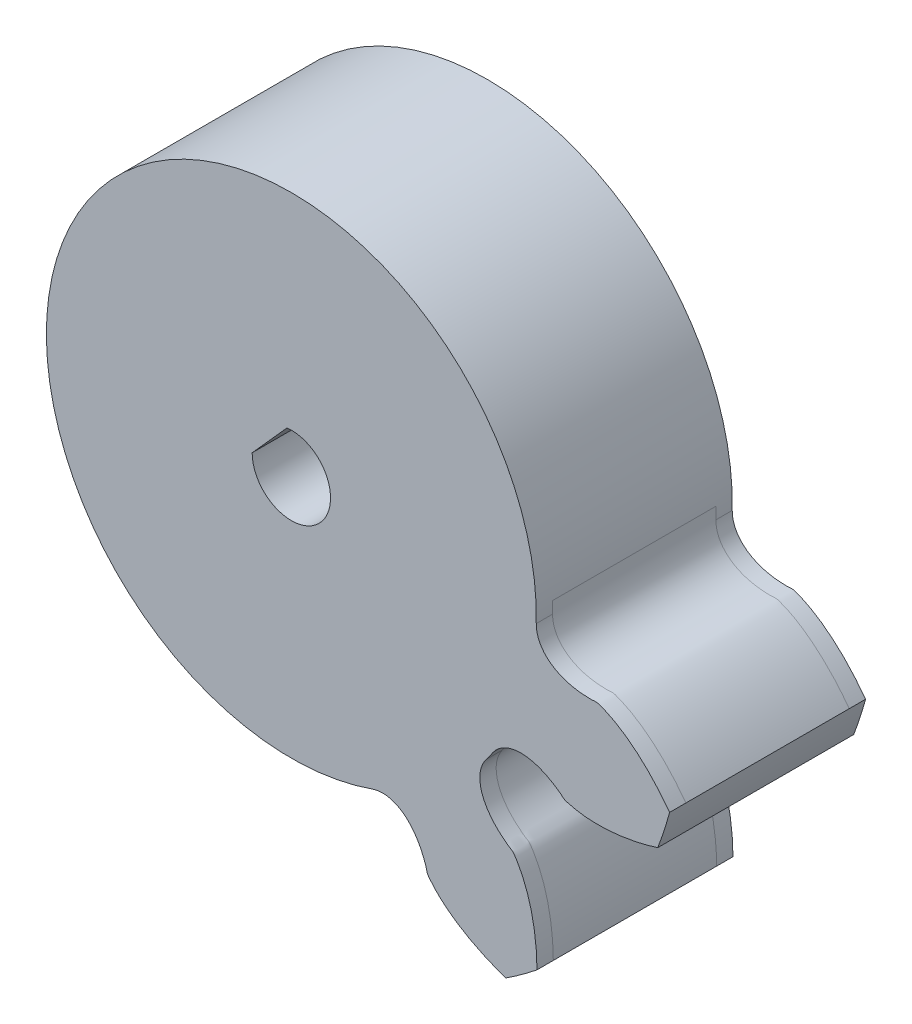
from build123d import *

# Parameters (mm, degrees)
SKETCHREVOLVESPUR01_W       = 6
SKETCHREVOLVESPUR01_H       = 11.99999982
TOOTHEXTRUDECUTSPUR01_DEPTH = 2.5
PATTERNSPUR01_COUNT         = 3
PATTERNSPUR01_ANGLE         = 72
CUT_EXTRUDE4_DEPTH          = 18.999999926
SCALE1_SCALE                = 1.25
CUT_EXTRUDE6_DEPTH          = 21.575620634
BOSS_EXTRUDE3_START         = 3
BOSS_EXTRUDE3_DEPTH         = 3
SKETCH13_R                  = 1
CUT_EXTRUDE7_DEPTH          = 3


with BuildPart() as part:
    # SketchRevolveSpur01 → Spur01 (revolve)
    with BuildSketch(Plane(origin=(0, 0, 0), x_dir=(0, 0, -1), z_dir=(1, 0, 0)), mode=Mode.PRIVATE) as spur01_sk:
        with Locations((0, 5.99999991)):
            Rectangle(SKETCHREVOLVESPUR01_W, SKETCHREVOLVESPUR01_H)
    revolve(spur01_sk.sketch.rotate(Axis((0, 0, 0), (0, 0, -1)), 90), axis=Axis((0, 0, 0), (0, 0, -1)))

    # SketchToothSpur01 → ToothExtrudeCutSpur01 (cut, symmetric)
    with BuildSketch(Plane.XY):
        with BuildLine():
            ThreePointArc((11.655653982, 3.248957658), (12.099999818, 0), (11.655653982, -3.248957658))
            add(Edge.make_bspline(
                [(11.655653982, -3.248957658), (11.542287726, -3.089305996), (11.367738762, -2.862436555), (11.123534782, -2.583010481), (10.947999265, -2.397865834), (10.776192053, -2.230764528), (10.609269419, -2.081082218), (10.44834245, -1.948131117), (10.294473867, -1.831161756), (10.148674628, -1.729370493), (10.011902198, -1.641886679), (9.885053932, -1.567827248), (9.768976882, -1.506134891), (9.664426294, -1.45610176), (9.572183953, -1.415767403), (9.474218443, -1.379996288), (9.351476065, -1.328641113), (9.21414192, -1.355832051), (9.089686, -1.350996807), (8.991189949, -1.347769188), (8.895083812, -1.340387735), (8.801254328, -1.330142809), (8.709751295, -1.316726231), (8.620575928, -1.300229256), (8.533736646, -1.280620754), (8.449236025, -1.257878982), (8.367076474, -1.231952957), (8.287262228, -1.202767588), (8.209803923, -1.170216951), (8.134724742, -1.134160443), (8.062069108, -1.094418466), (7.991914548, -1.050769425), (7.924387429, -1.002949027), (7.859683092, -0.950653937), (7.798090337, -0.893552503), (7.740018842, -0.831306192), (7.686026832, -0.763605636), (7.636840194, -0.690224751), (7.593362614, -0.611092562), (7.55662796, -0.526379885), (7.527823561, -0.436575845), (7.507840639, -0.342571173), (7.499499015, -0.256553159), (7.496355153, -0.142125776), (7.502676626, 0), (7.496355153, 0.142125776), (7.499499015, 0.256553159), (7.507840639, 0.342571173), (7.527823561, 0.436575845), (7.55662796, 0.526379885), (7.593362614, 0.611092562), (7.636840194, 0.690224751), (7.686026832, 0.763605636), (7.740018842, 0.831306192), (7.798090337, 0.893552503), (7.859683092, 0.950653937), (7.924387429, 1.002949027), (7.991914548, 1.050769425), (8.062069108, 1.094418466), (8.134724742, 1.134160443), (8.209803923, 1.170216951), (8.287262228, 1.202767588), (8.367076474, 1.231952957), (8.449236025, 1.257878982), (8.533736646, 1.280620754), (8.620575928, 1.300229256), (8.709751295, 1.316726231), (8.801254328, 1.330142809), (8.895083812, 1.340387735), (8.991189949, 1.347769188), (9.089686, 1.350996807), (9.21414192, 1.355832051), (9.351476065, 1.328641113), (9.474218443, 1.379996288), (9.572183953, 1.415767403), (9.664426294, 1.45610176), (9.768976882, 1.506134891), (9.885053932, 1.567827248), (10.011902198, 1.641886679), (10.148674628, 1.729370493), (10.294473867, 1.831161756), (10.44834245, 1.948131117), (10.609269419, 2.081082218), (10.776192053, 2.230764528), (10.947999265, 2.397865834), (11.123534782, 2.583010481), (11.367738762, 2.862436555), (11.542287726, 3.089305996), (11.655653982, 3.248957658)],
                knots=[0, 0, 0, 0, 0.051709588, 0.075523214, 0.097976061, 0.11906813, 0.138799421, 0.157169932, 0.174179665, 0.18982862, 0.204116796, 0.217044194, 0.228610813, 0.238816653, 0.247661716, 0.255145999, 0.266488168, 0.281932497, 0.29079109, 0.29945754, 0.3079389, 0.316243077, 0.32437896, 0.33235655, 0.340187113, 0.347883348, 0.355459572, 0.362931907, 0.370318475, 0.377639574, 0.384917807, 0.392178142, 0.399447816, 0.40675603, 0.414133302, 0.42161038, 0.429216569, 0.436977418, 0.444911792, 0.453028613, 0.461323803, 0.469778278, 0.478357898, 0.484105769, 0.5, 0.515894231, 0.521642102, 0.530221722, 0.538676197, 0.546971387, 0.555088208, 0.563022582, 0.570783431, 0.57838962, 0.585866698, 0.59324397, 0.600552184, 0.607821858, 0.615082193, 0.622360426, 0.629681525, 0.637068093, 0.644540428, 0.652116652, 0.659812887, 0.66764345, 0.67562104, 0.683756923, 0.6920611, 0.70054246, 0.70920891, 0.718067503, 0.733511832, 0.744854001, 0.752338284, 0.761183347, 0.771389187, 0.782955806, 0.795883204, 0.81017138, 0.825820335, 0.842830068, 0.861200579, 0.88093187, 0.902023939, 0.924476786, 0.948290412, 1, 1, 1, 1], degree=3))
        make_face()
    toothextrudecutspur01 = extrude(amount=TOOTHEXTRUDECUTSPUR01_DEPTH, both=True, mode=Mode.SUBTRACT)

    # PatternSpur01: ToothExtrudeCutSpur01 ×3 about axis
    patternspur01_axis = Axis((0, 0, 55), (0, 0, -1))
    for i in range(1, PATTERNSPUR01_COUNT):
        add(toothextrudecutspur01.rotate(patternspur01_axis, i * PATTERNSPUR01_ANGLE / (PATTERNSPUR01_COUNT - 1)), mode=Mode.SUBTRACT)

    # Sketch5 → Cut-Extrude4 (cut, through all)
    with BuildSketch(Plane.XY.offset(3)):
        with BuildLine():
            ThreePointArc((2.145249768, -7.186647462), (-6.067627367, 4.408389326), (7.497826535, 0.180542427))
            add(Edge.make_bspline(
                [(7.497826535, 0.180542427), (7.498008575, 0.202305514), (7.499499015, 0.256553159), (7.507840639, 0.342571173), (7.527823561, 0.436575845), (7.55662796, 0.526379885), (7.593362614, 0.611092562), (7.636840194, 0.690224751), (7.686026832, 0.763605636), (7.740018842, 0.831306192), (7.798090337, 0.893552503), (7.859683092, 0.950653937), (7.924387429, 1.002949027), (7.991914548, 1.050769425), (8.062069108, 1.094418466), (8.134724742, 1.134160443), (8.209803923, 1.170216951), (8.287262228, 1.202767588), (8.367076474, 1.231952957), (8.449236025, 1.257878982), (8.533736646, 1.280620754), (8.620575928, 1.300229256), (8.709751295, 1.316726231), (8.801254328, 1.330142809), (8.895083812, 1.340387735), (8.991189949, 1.347769188), (9.089686, 1.350996807), (9.21414192, 1.355832051), (9.351476065, 1.328641113), (9.474218443, 1.379996288), (9.572183953, 1.415767403), (9.664426294, 1.45610176), (9.768976882, 1.506134891), (9.885053932, 1.567827248), (10.011902198, 1.641886679), (10.148674628, 1.729370493), (10.294473867, 1.831161756), (10.44834245, 1.948131117), (10.609269419, 2.081082218), (10.776192053, 2.230764528), (10.947999265, 2.397865834), (11.123534782, 2.583010481), (11.339604557, 2.83024449), (11.489806134, 3.021747144), (11.580533103, 3.145035568)],
                knots=[0.515894231, 0.515894231, 0.515894231, 0.515894231, 0.521642102, 0.530221722, 0.538676197, 0.546971387, 0.555088208, 0.563022582, 0.570783431, 0.57838962, 0.585866698, 0.59324397, 0.600552184, 0.607821858, 0.615082193, 0.622360426, 0.629681525, 0.637068093, 0.644540428, 0.652116652, 0.659812887, 0.66764345, 0.67562104, 0.683756923, 0.6920611, 0.70054246, 0.70920891, 0.718067503, 0.733511832, 0.744854001, 0.752338284, 0.761183347, 0.771389187, 0.782955806, 0.795883204, 0.81017138, 0.825820335, 0.842830068, 0.861200579, 0.88093187, 0.902023939, 0.924476786, 0.948290412, 0.988712393, 0.988712393, 0.988712393, 0.988712393], degree=3))
            ThreePointArc((11.580533103, 3.145035568), (-9.708203787, 7.053422922), (0.587474962, -11.985610908))
            add(Edge.make_bspline(
                [(0.587474962, -11.985610908), (0.676693046, -11.861226215), (0.812408053, -11.659198451), (0.980772335, -11.377304374), (1.1026119, -11.153147334), (1.208443338, -10.938111822), (1.299217744, -10.733104587), (1.375932586, -10.538969794), (1.439629052, -10.356486555), (1.491383854, -10.186368009), (1.532320901, -10.029255713), (1.563557335, -9.88573022), (1.586360472, -9.756270398), (1.601636899, -9.641375792), (1.6114927, -9.541184111), (1.615240045, -9.436959492), (1.626152238, -9.304354932), (1.557853535, -9.182144861), (1.523993131, -9.062286074), (1.496625826, -8.967613374), (1.473947574, -8.873930012), (1.454696173, -8.781527013), (1.439180105, -8.690356507), (1.427312956, -8.600447848), (1.419126937, -8.511799422), (1.414643518, -8.424406961), (1.413911936, -8.338257003), (1.417004913, -8.253330369), (1.424026476, -8.169604443), (1.43511751, -8.087057825), (1.45046255, -8.005677265), (1.470296304, -7.925468018), (1.494909177, -7.846468596), (1.524650025, -7.768771043), (1.559923507, -7.692547539), (1.601178188, -7.618083097), (1.648880794, -7.545813021), (1.703470656, -7.476357808), (1.765294529, -7.410554982), (1.83450944, -7.349440593), (1.911017108, -7.294295007), (1.994245802, -7.246241077), (2.073476091, -7.211726693), (2.124608096, -7.193545757), (2.145249768, -7.186647462)],
                knots=[0.011287607, 0.011287607, 0.011287607, 0.011287607, 0.051709588, 0.075523214, 0.097976061, 0.11906813, 0.138799421, 0.157169932, 0.174179665, 0.18982862, 0.204116796, 0.217044194, 0.228610813, 0.238816653, 0.247661716, 0.255145999, 0.266488168, 0.281932497, 0.29079109, 0.29945754, 0.3079389, 0.316243077, 0.32437896, 0.33235655, 0.340187113, 0.347883348, 0.355459572, 0.362931907, 0.370318475, 0.377639574, 0.384917807, 0.392178142, 0.399447816, 0.40675603, 0.414133302, 0.42161038, 0.429216569, 0.436977418, 0.444911792, 0.453028613, 0.461323803, 0.469778278, 0.478357898, 0.484105769, 0.484105769, 0.484105769, 0.484105769], degree=3))
        make_face()
        with BuildLine():
            add(Edge.make_bspline(
                [(6.171989263, -4.26104997), (6.184928559, -4.243550263), (6.218020316, -4.200539055), (6.275328951, -4.135852103), (6.346750035, -4.071546393), (6.422838774, -4.0158242), (6.502350595, -3.968882292), (6.584037429, -3.930418487), (6.666962457, -3.899963284), (6.7504363, -3.876928091), (6.83400459, -3.860703336), (6.917397556, -3.850710619), (7.000482747, -3.846435256), (7.083221458, -3.847439187), (7.165633953, -3.853362187), (7.247773342, -3.863916162), (7.32970716, -3.87887627), (7.411505029, -3.8980711), (7.493230841, -3.921373278), (7.574938248, -3.948690855), (7.656667965, -3.979960595), (7.738448009, -4.015139832), (7.820289074, -4.054209465), (7.90220265, -4.097139358), (7.984134114, -4.144002626), (8.06622432, -4.194520675), (8.147806447, -4.249804003), (8.251335487, -4.319045562), (8.346458711, -4.421766478), (8.475945195, -4.452365428), (8.576226692, -4.48100867), (8.674560253, -4.502596178), (8.788552192, -4.523571819), (8.918722356, -4.541890031), (9.0648758, -4.556534234), (9.226948716, -4.566151158), (9.404734182, -4.569498939), (9.597969345, -4.565310422), (9.806308695, -4.552341221), (10.029332996, -4.529360351), (10.266547634, -4.4951583), (10.517384143, -4.448550322), (10.837508767, -4.375536435), (11.071586832, -4.308893805), (11.217453609, -4.262479349)],
                knots=[0.515894231, 0.515894231, 0.515894231, 0.515894231, 0.521642102, 0.530221722, 0.538676197, 0.546971387, 0.555088208, 0.563022582, 0.570783431, 0.57838962, 0.585866698, 0.59324397, 0.600552184, 0.607821858, 0.615082193, 0.622360426, 0.629681525, 0.637068093, 0.644540428, 0.652116652, 0.659812887, 0.66764345, 0.67562104, 0.683756923, 0.6920611, 0.70054246, 0.70920891, 0.718067503, 0.733511832, 0.744854001, 0.752338284, 0.761183347, 0.771389187, 0.782955806, 0.795883204, 0.81017138, 0.825820335, 0.842830068, 0.861200579, 0.88093187, 0.902023939, 0.924476786, 0.948290412, 0.988712393, 0.988712393, 0.988712393, 0.988712393], degree=3))
            ThreePointArc((6.171989263, -4.26104997), (6.120251718, -4.335033705), (6.067627375, -4.408389314))
            ThreePointArc((6.067627375, -4.408389314), (6.014123853, -4.481106179), (5.959748911, -4.553173753))
            add(Edge.make_bspline(
                [(7.520242559, -9.351253794), (7.519310017, -9.19818339), (7.510356824, -8.954968216), (7.480873208, -8.627949074), (7.447687285, -8.37498672), (7.406912015, -8.138813178), (7.359849821, -7.919602984), (7.307803865, -7.717452784), (7.252074432, -7.532380899), (7.193951773, -7.364331395), (7.134722249, -7.213162685), (7.075630887, -7.078687808), (7.017984438, -6.960549264), (6.962809972, -6.858618316), (6.911892291, -6.771768449), (6.853662262, -6.685246327), (6.784547407, -6.571552958), (6.657459318, -6.512827904), (6.559614449, -6.435762755), (6.481826616, -6.37525703), (6.408413827, -6.31279554), (6.338525996, -6.249355633), (6.272384555, -6.18471726), (6.209936846, -6.118954962), (6.15120798, -6.0520485), (6.096212818, -5.983981802), (6.044983281, -5.914715035), (5.997566929, -5.844189938), (5.954034628, -5.772327071), (5.914487779, -5.699026307), (5.879067884, -5.624168463), (5.847967915, -5.54761983), (5.821445453, -5.469240872), (5.799836828, -5.388901), (5.783570623, -5.306501657), (5.77317726, -5.222009765), (5.769290195, -5.135503157), (5.772629571, -5.047225593), (5.783968203, -4.957650828), (5.804042106, -4.867524745), (5.833524348, -4.777940949), (5.872612384, -4.690143905), (5.916423989, -4.615650786), (5.947104164, -4.570887461), (5.959748911, -4.553173753)],
                knots=[0.011287607, 0.011287607, 0.011287607, 0.011287607, 0.051709588, 0.075523214, 0.097976061, 0.11906813, 0.138799421, 0.157169932, 0.174179665, 0.18982862, 0.204116796, 0.217044194, 0.228610813, 0.238816653, 0.247661716, 0.255145999, 0.266488168, 0.281932497, 0.29079109, 0.29945754, 0.3079389, 0.316243077, 0.32437896, 0.33235655, 0.340187113, 0.347883348, 0.355459572, 0.362931907, 0.370318475, 0.377639574, 0.384917807, 0.392178142, 0.399447816, 0.40675603, 0.414133302, 0.42161038, 0.429216569, 0.436977418, 0.444911792, 0.453028613, 0.461323803, 0.469778278, 0.478357898, 0.484105769, 0.484105769, 0.484105769, 0.484105769], degree=3))
            ThreePointArc((7.520242559, -9.351253794), (9.708203787, -7.053422922), (11.217453609, -4.262479349))
        make_face()
        with BuildLine():
            ThreePointArc((2.31762746, -7.132923753), (2.231600289, -7.160304355), (2.145249768, -7.186647462))
            add(Edge.make_bspline(
                [(0.587474962, -11.985610908), (0.676693046, -11.861226215), (0.812408053, -11.659198451), (0.980772335, -11.377304374), (1.1026119, -11.153147334), (1.208443338, -10.938111822), (1.299217744, -10.733104587), (1.375932586, -10.538969794), (1.439629052, -10.356486555), (1.491383854, -10.186368009), (1.532320901, -10.029255713), (1.563557335, -9.88573022), (1.586360472, -9.756270398), (1.601636899, -9.641375792), (1.6114927, -9.541184111), (1.615240045, -9.436959492), (1.626152238, -9.304354932), (1.557853535, -9.182144861), (1.523993131, -9.062286074), (1.496625826, -8.967613374), (1.473947574, -8.873930012), (1.454696173, -8.781527013), (1.439180105, -8.690356507), (1.427312956, -8.600447848), (1.419126937, -8.511799422), (1.414643518, -8.424406961), (1.413911936, -8.338257003), (1.417004913, -8.253330369), (1.424026476, -8.169604443), (1.43511751, -8.087057825), (1.45046255, -8.005677265), (1.470296304, -7.925468018), (1.494909177, -7.846468596), (1.524650025, -7.768771043), (1.559923507, -7.692547539), (1.601178188, -7.618083097), (1.648880794, -7.545813021), (1.703470656, -7.476357808), (1.765294529, -7.410554982), (1.83450944, -7.349440593), (1.911017108, -7.294295007), (1.994245802, -7.246241077), (2.073476091, -7.211726693), (2.124608096, -7.193545757), (2.145249768, -7.186647462)],
                knots=[0.011287607, 0.011287607, 0.011287607, 0.011287607, 0.051709588, 0.075523214, 0.097976061, 0.11906813, 0.138799421, 0.157169932, 0.174179665, 0.18982862, 0.204116796, 0.217044194, 0.228610813, 0.238816653, 0.247661716, 0.255145999, 0.266488168, 0.281932497, 0.29079109, 0.29945754, 0.3079389, 0.316243077, 0.32437896, 0.33235655, 0.340187113, 0.347883348, 0.355459572, 0.362931907, 0.370318475, 0.377639574, 0.384917807, 0.392178142, 0.399447816, 0.40675603, 0.414133302, 0.42161038, 0.429216569, 0.436977418, 0.444911792, 0.453028613, 0.461323803, 0.469778278, 0.478357898, 0.484105769, 0.484105769, 0.484105769, 0.484105769], degree=3))
            ThreePointArc((0.587474962, -11.985610908), (3.708203877, -11.412678024), (6.569688104, -10.041872031))
            add(Edge.make_bspline(
                [(2.488661872, -7.075066106), (2.509416051, -7.068514073), (2.561469199, -7.053168121), (2.645854895, -7.034520448), (2.741433714, -7.024476296), (2.83574348, -7.024119933), (2.927661656, -7.032879008), (3.01635615, -7.049775452), (3.101345026, -7.073878784), (3.18241653, -7.104307615), (3.259561369, -7.140301721), (3.332901267, -7.181234599), (3.402631593, -7.226612008), (3.468978521, -7.276056799), (3.532170178, -7.329289455), (3.592418869, -7.386108123), (3.649911389, -7.446370593), (3.704804817, -7.509979119), (3.757225711, -7.576868203), (3.807271524, -7.646994996), (3.855012362, -7.720332269), (3.90049597, -7.796861974), (3.943742229, -7.876574942), (3.984778145, -7.959453547), (4.023516554, -8.045524833), (4.060235162, -8.134646207), (4.093741764, -8.227324129), (4.136799349, -8.34419457), (4.153377815, -8.483209565), (4.240148969, -8.584074882), (4.304442329, -8.666191736), (4.371307033, -8.741455414), (4.451199276, -8.825427844), (4.545741976, -8.916759692), (4.65537495, -9.01451394), (4.780842007, -9.117558265), (4.922705694, -9.224766351), (5.081498174, -9.334958549), (5.257671353, -9.446925042), (5.45160962, -9.559423523), (5.663623754, -9.671184748), (5.893950235, -9.780916103), (6.195852982, -9.91001116), (6.424397669, -9.993683775), (6.569688104, -10.041872031)],
                knots=[0.515894231, 0.515894231, 0.515894231, 0.515894231, 0.521642102, 0.530221722, 0.538676197, 0.546971387, 0.555088208, 0.563022582, 0.570783431, 0.57838962, 0.585866698, 0.59324397, 0.600552184, 0.607821858, 0.615082193, 0.622360426, 0.629681525, 0.637068093, 0.644540428, 0.652116652, 0.659812887, 0.66764345, 0.67562104, 0.683756923, 0.6920611, 0.70054246, 0.70920891, 0.718067503, 0.733511832, 0.744854001, 0.752338284, 0.761183347, 0.771389187, 0.782955806, 0.795883204, 0.81017138, 0.825820335, 0.842830068, 0.861200579, 0.88093187, 0.902023939, 0.924476786, 0.948290412, 0.988712393, 0.988712393, 0.988712393, 0.988712393], degree=3))
            ThreePointArc((2.488661872, -7.075066106), (2.403318781, -7.104509635), (2.31762746, -7.132923753))
        make_face()
        with BuildLine():
            ThreePointArc((7.497826535, 0.180542427), (7.499456529, 0.090277754), (7.499999887, 0))
            ThreePointArc((7.499999887, 0), (7.499456529, -0.090277754), (7.497826535, -0.180542427))
            add(Edge.make_bspline(
                [(11.580533103, -3.145035568), (11.489806134, -3.021747144), (11.339604557, -2.83024449), (11.123534782, -2.583010481), (10.947999265, -2.397865834), (10.776192053, -2.230764528), (10.609269419, -2.081082218), (10.44834245, -1.948131117), (10.294473867, -1.831161756), (10.148674628, -1.729370493), (10.011902198, -1.641886679), (9.885053932, -1.567827248), (9.768976882, -1.506134891), (9.664426294, -1.45610176), (9.572183953, -1.415767403), (9.474218443, -1.379996288), (9.351476065, -1.328641113), (9.21414192, -1.355832051), (9.089686, -1.350996807), (8.991189949, -1.347769188), (8.895083812, -1.340387735), (8.801254328, -1.330142809), (8.709751295, -1.316726231), (8.620575928, -1.300229256), (8.533736646, -1.280620754), (8.449236025, -1.257878982), (8.367076474, -1.231952957), (8.287262228, -1.202767588), (8.209803923, -1.170216951), (8.134724742, -1.134160443), (8.062069108, -1.094418466), (7.991914548, -1.050769425), (7.924387429, -1.002949027), (7.859683092, -0.950653937), (7.798090337, -0.893552503), (7.740018842, -0.831306192), (7.686026832, -0.763605636), (7.636840194, -0.690224751), (7.593362614, -0.611092562), (7.55662796, -0.526379885), (7.527823561, -0.436575845), (7.507840639, -0.342571173), (7.499499015, -0.256553159), (7.498008575, -0.202305514), (7.497826535, -0.180542427)],
                knots=[0.011287607, 0.011287607, 0.011287607, 0.011287607, 0.051709588, 0.075523214, 0.097976061, 0.11906813, 0.138799421, 0.157169932, 0.174179665, 0.18982862, 0.204116796, 0.217044194, 0.228610813, 0.238816653, 0.247661716, 0.255145999, 0.266488168, 0.281932497, 0.29079109, 0.29945754, 0.3079389, 0.316243077, 0.32437896, 0.33235655, 0.340187113, 0.347883348, 0.355459572, 0.362931907, 0.370318475, 0.377639574, 0.384917807, 0.392178142, 0.399447816, 0.40675603, 0.414133302, 0.42161038, 0.429216569, 0.436977418, 0.444911792, 0.453028613, 0.461323803, 0.469778278, 0.478357898, 0.484105769, 0.484105769, 0.484105769, 0.484105769], degree=3))
            ThreePointArc((11.580533103, -3.145035568), (11.894670883, -1.586442644), (11.99999982, 0))
            ThreePointArc((11.99999982, 0), (11.894670883, 1.586442644), (11.580533103, 3.145035568))
            add(Edge.make_bspline(
                [(7.497826535, 0.180542427), (7.498008575, 0.202305514), (7.499499015, 0.256553159), (7.507840639, 0.342571173), (7.527823561, 0.436575845), (7.55662796, 0.526379885), (7.593362614, 0.611092562), (7.636840194, 0.690224751), (7.686026832, 0.763605636), (7.740018842, 0.831306192), (7.798090337, 0.893552503), (7.859683092, 0.950653937), (7.924387429, 1.002949027), (7.991914548, 1.050769425), (8.062069108, 1.094418466), (8.134724742, 1.134160443), (8.209803923, 1.170216951), (8.287262228, 1.202767588), (8.367076474, 1.231952957), (8.449236025, 1.257878982), (8.533736646, 1.280620754), (8.620575928, 1.300229256), (8.709751295, 1.316726231), (8.801254328, 1.330142809), (8.895083812, 1.340387735), (8.991189949, 1.347769188), (9.089686, 1.350996807), (9.21414192, 1.355832051), (9.351476065, 1.328641113), (9.474218443, 1.379996288), (9.572183953, 1.415767403), (9.664426294, 1.45610176), (9.768976882, 1.506134891), (9.885053932, 1.567827248), (10.011902198, 1.641886679), (10.148674628, 1.729370493), (10.294473867, 1.831161756), (10.44834245, 1.948131117), (10.609269419, 2.081082218), (10.776192053, 2.230764528), (10.947999265, 2.397865834), (11.123534782, 2.583010481), (11.339604557, 2.83024449), (11.489806134, 3.021747144), (11.580533103, 3.145035568)],
                knots=[0.515894231, 0.515894231, 0.515894231, 0.515894231, 0.521642102, 0.530221722, 0.538676197, 0.546971387, 0.555088208, 0.563022582, 0.570783431, 0.57838962, 0.585866698, 0.59324397, 0.600552184, 0.607821858, 0.615082193, 0.622360426, 0.629681525, 0.637068093, 0.644540428, 0.652116652, 0.659812887, 0.66764345, 0.67562104, 0.683756923, 0.6920611, 0.70054246, 0.70920891, 0.718067503, 0.733511832, 0.744854001, 0.752338284, 0.761183347, 0.771389187, 0.782955806, 0.795883204, 0.81017138, 0.825820335, 0.842830068, 0.861200579, 0.88093187, 0.902023939, 0.924476786, 0.948290412, 0.988712393, 0.988712393, 0.988712393, 0.988712393], degree=3))
        make_face()
    extrude(amount=-CUT_EXTRUDE4_DEPTH, mode=Mode.SUBTRACT)


with BuildPart() as part_1:
    # Scale1: scaled about (0, 0, 0)
    add(part.part.scale(SCALE1_SCALE))

    # Sketch9 → Cut-Extrude6 (cut, through all)
    with BuildSketch(Plane(origin=(0, 0, -3.75), x_dir=(-1, 0, 0), z_dir=(0, 0, -1))):
        with BuildLine():
            ThreePointArc((0.166666667, 1.490711985), (-1.118033989, -1), (1.5, 0))
            Line((1.5, 0), (0.166666667, 1.490711985))
        make_face()
    extrude(amount=-CUT_EXTRUDE6_DEPTH, mode=Mode.SUBTRACT)

    # Sketch12 → Boss-Extrude3 (add)
    with BuildSketch(Plane(origin=(0, 0, -3.75), x_dir=(-1, 0, 0), z_dir=(0, 0, -1)).offset(BOSS_EXTRUDE3_START)):
        with BuildLine():
            Line((4.278955144, 1.393033696), (1.859847478, 4.097678289))
            ThreePointArc((1.859847478, 4.097678289), (-3.354101966, -3), (4.278955144, 1.393033696))
        make_face()
        with BuildLine():
            Line((1.5, 0), (0.166666667, 1.490711985))
            ThreePointArc((0.166666667, 1.490711985), (-1.118033989, -1), (1.5, 0))
        make_face(mode=Mode.SUBTRACT)
    extrude(amount=-BOSS_EXTRUDE3_DEPTH)

    # Sketch13 → Cut-Extrude7 (cut)
    with BuildSketch(Plane(origin=(-3.069401311, 2.745355992, 0), x_dir=(0, 0, 1), z_dir=(-0.7453559924999299, 0.6666666666666667, 0))):
        with Locations(Location((-5.25, 0, 0), (0, 0, 270))):
            Circle(SKETCH13_R)
    extrude(amount=-CUT_EXTRUDE7_DEPTH, mode=Mode.SUBTRACT)


solid = part_1.part
